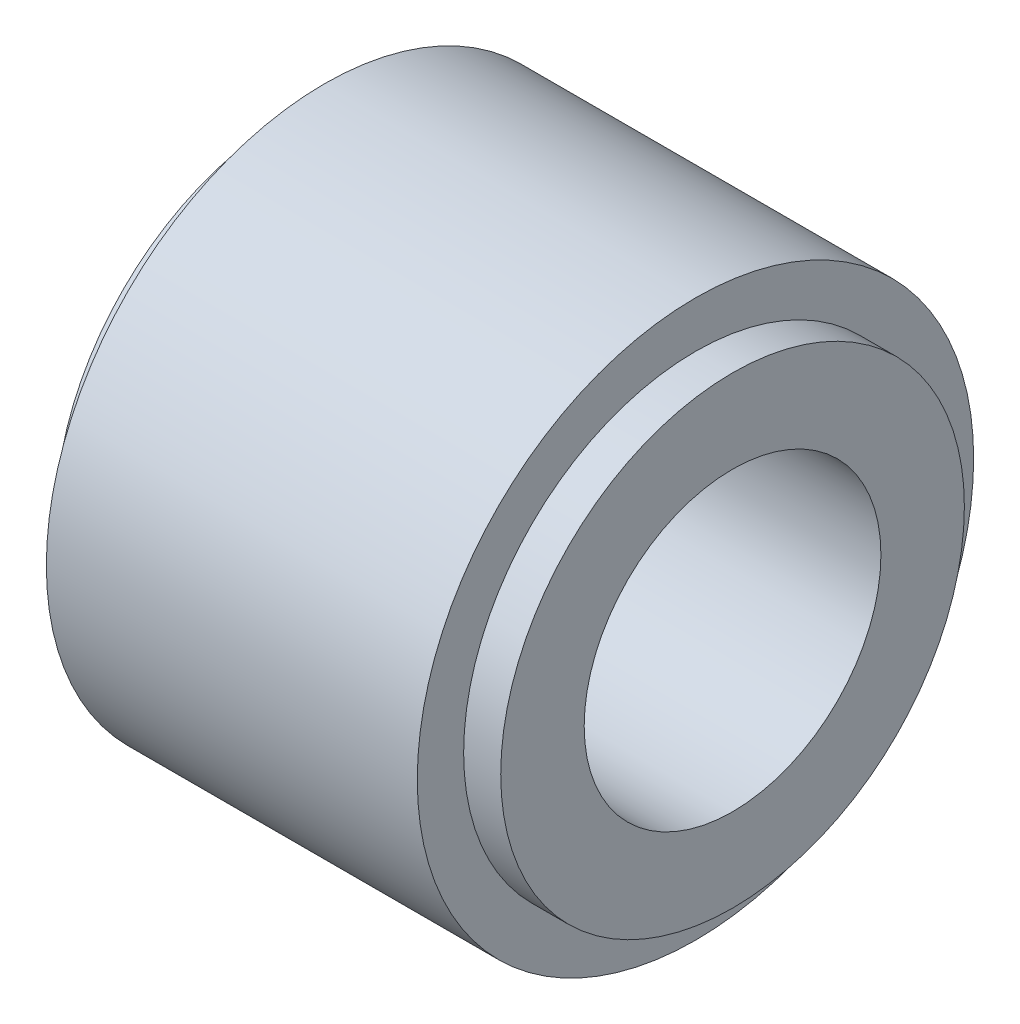
from build123d import *

# Parameters (mm, degrees)
SKETCH2_W = 24
SKETCH2_H = 8


with BuildPart() as part:
    # Sketch1 → Revolve1 (revolve)
    with BuildSketch(Plane.XY, mode=Mode.PRIVATE) as revolve1_sk:
        Polygon((0, 0), (0, 12.5), (2, 12.5), (2, 15), (22, 15), (22, 12.5), (24, 12.5), (24, 0), align=None)
    revolve(revolve1_sk.sketch.rotate(Axis((-4.047229768, 0, 0), (1, 0, 0)), 90), axis=Axis((-4.047229768, 0, 0), (1, 0, 0)))

    # Sketch2 → Cut-Revolve1 (revolve, cut)
    with BuildSketch(Plane.XY, mode=Mode.PRIVATE) as cut_revolve1_sk:
        with Locations((12, 4)):
            Rectangle(SKETCH2_W, SKETCH2_H)
    revolve(cut_revolve1_sk.sketch.rotate(Axis((-2.968632144, 0, 0), (1, 0, 0)), 90), axis=Axis((-2.968632144, 0, 0), (1, 0, 0)), mode=Mode.SUBTRACT)


solid = part.part
